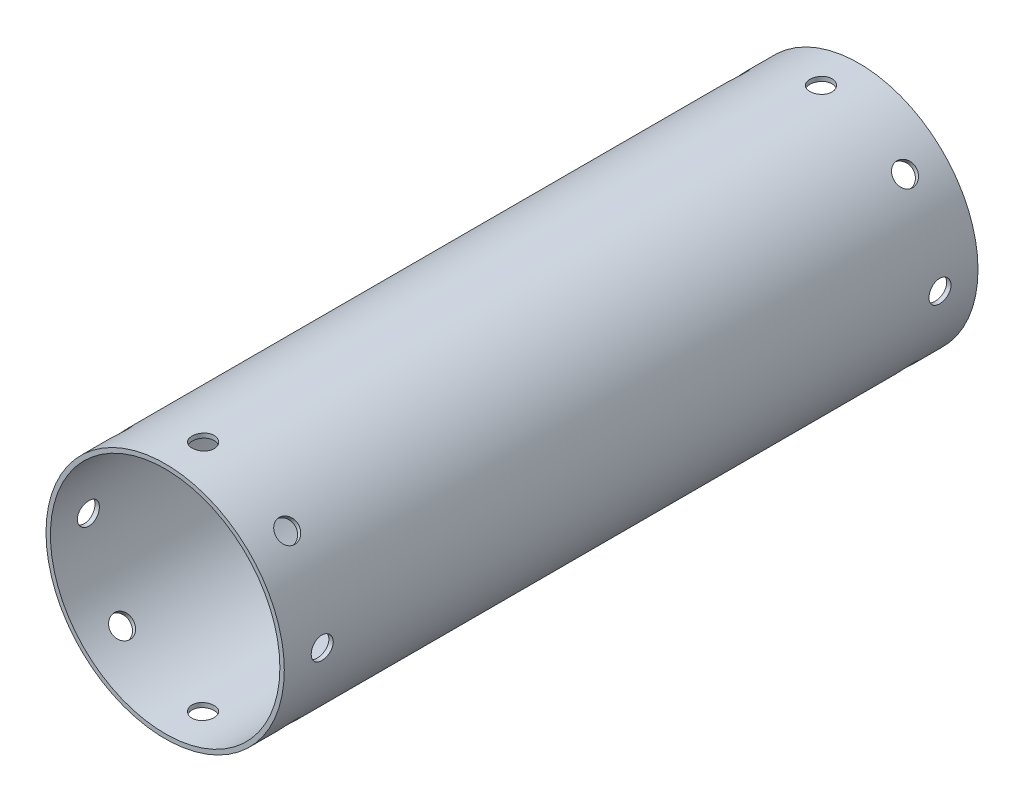
from build123d import *

# Parameters (mm, degrees)
SKETCH1_R                      = 27
SKETCH1_R_2                    = 26
BOSS_EXTRUDE1_DEPTH            = 157.2
CUT_EXTRUDE1_REACH             = 163.771
SKETCH2_R                      = 2.5
CUT_EXTRUDE1_DIRECTION_2_DEPTH = 1
LPATTERN1_COUNT                = 2
LPATTERN1_PITCH                = 140
CIRPATTERN2_COPY_1_REACH       = 163.771
CIRPATTERN2_COPY_1_SKETCH_R    = 2.5
CIRPATTERN2_COPY_2_REACH       = 163.771
CIRPATTERN2_COPY_2_SKETCH_R    = 2.5
CIRPATTERN2_COPY_3_REACH       = 163.771
CIRPATTERN2_COPY_3_SKETCH_R    = 2.5
CIRPATTERN2_COPY_4_REACH       = 163.771
CIRPATTERN2_COPY_4_SKETCH_R    = 2.5
CIRPATTERN2_COPY_5_REACH       = 163.771
CIRPATTERN2_COPY_5_SKETCH_R    = 2.5
CIRPATTERN2_COPY_6_REACH       = 163.771
CIRPATTERN2_COPY_6_SKETCH_R    = 2.5
CIRPATTERN2_COPY_7_REACH       = 163.771
CIRPATTERN2_COPY_7_SKETCH_R    = 2.5
CIRPATTERN2_COPY_8_SKETCH_R    = 2.5
CIRPATTERN2_COPY_8_DEPTH       = 1
CIRPATTERN2_COPY_9_SKETCH_R    = 2.5
CIRPATTERN2_COPY_9_DEPTH       = 1
CIRPATTERN2_COPY_10_SKETCH_R   = 2.5
CIRPATTERN2_COPY_10_DEPTH      = 1
CIRPATTERN2_COPY_11_SKETCH_R   = 2.5
CIRPATTERN2_COPY_11_DEPTH      = 1
CIRPATTERN2_COPY_12_SKETCH_R   = 2.5
CIRPATTERN2_COPY_12_DEPTH      = 1
CIRPATTERN2_COPY_13_SKETCH_R   = 2.5
CIRPATTERN2_COPY_13_DEPTH      = 1
CIRPATTERN2_COPY_14_SKETCH_R   = 2.5
CIRPATTERN2_COPY_14_DEPTH      = 1
CIRPATTERN2_COPY_15_REACH      = 163.771
CIRPATTERN2_COPY_15_SKETCH_R   = 2.5
CIRPATTERN2_COPY_16_REACH      = 163.771
CIRPATTERN2_COPY_16_SKETCH_R   = 2.5
CIRPATTERN2_COPY_17_REACH      = 163.771
CIRPATTERN2_COPY_17_SKETCH_R   = 2.5
CIRPATTERN2_COPY_18_REACH      = 163.771
CIRPATTERN2_COPY_18_SKETCH_R   = 2.5
CIRPATTERN2_COPY_19_REACH      = 163.771
CIRPATTERN2_COPY_19_SKETCH_R   = 2.5
CIRPATTERN2_COPY_20_REACH      = 163.771
CIRPATTERN2_COPY_20_SKETCH_R   = 2.5
CIRPATTERN2_COPY_21_REACH      = 163.771
CIRPATTERN2_COPY_21_SKETCH_R   = 2.5
CIRPATTERN2_COPY_22_SKETCH_R   = 2.5
CIRPATTERN2_COPY_22_DEPTH      = 1
CIRPATTERN2_COPY_23_SKETCH_R   = 2.5
CIRPATTERN2_COPY_23_DEPTH      = 1
CIRPATTERN2_COPY_24_SKETCH_R   = 2.5
CIRPATTERN2_COPY_24_DEPTH      = 1
CIRPATTERN2_COPY_25_SKETCH_R   = 2.5
CIRPATTERN2_COPY_25_DEPTH      = 1
CIRPATTERN2_COPY_26_SKETCH_R   = 2.5
CIRPATTERN2_COPY_26_DEPTH      = 1
CIRPATTERN2_COPY_27_SKETCH_R   = 2.5
CIRPATTERN2_COPY_27_DEPTH      = 1
CIRPATTERN2_COPY_28_SKETCH_R   = 2.5
CIRPATTERN2_COPY_28_DEPTH      = 1


with BuildPart() as part:
    # Sketch1 → Boss-Extrude1 (new body)
    with BuildSketch(Plane.XY):
        Circle(SKETCH1_R)
        Circle(SKETCH1_R_2, mode=Mode.SUBTRACT)
    extrude(amount=BOSS_EXTRUDE1_DEPTH)

    # Sketch2 → Cut-Extrude1 (cut, up to next)
    with BuildSketch(Plane(origin=(0, 0, 0), x_dir=(1, 0, 0), z_dir=(0, 1, 0)), mode=Mode.PRIVATE) as cut_extrude1_sk1:
        with Locations((0, -8.6)):
            Circle(SKETCH2_R)
    cut_extrude1_tool1 = extrude(cut_extrude1_sk1.sketch, amount=-CUT_EXTRUDE1_REACH, mode=Mode.PRIVATE) & part.part
    cut_extrude1 = cut_extrude1_tool1.solids().sort_by_distance((0, 0, 8.6))[0]
    add(cut_extrude1, mode=Mode.SUBTRACT)

    # Sketch2 → Cut-Extrude1 direction 2 (cut)
    with BuildSketch(Plane(origin=(0, 0, 0), x_dir=(1, 0, 0), z_dir=(0, 1, 0))):
        with Locations((0, -8.6)):
            Circle(SKETCH2_R)
    cut_extrude1_direction_2 = extrude(amount=CUT_EXTRUDE1_DIRECTION_2_DEPTH, mode=Mode.SUBTRACT)

    # LPattern1: Cut-Extrude1, Cut-Extrude1 direction 2 ×2
    with Locations(*[(0, 0, i * LPATTERN1_PITCH) for i in range(1, LPATTERN1_COUNT)]):
        add(cut_extrude1, mode=Mode.SUBTRACT)
        add(cut_extrude1_direction_2, mode=Mode.SUBTRACT)

    # CirPattern2 copy 1 sketch → CirPattern2 copy 1 (cut, up to next)
    with BuildSketch(Plane(origin=(0, 0, 140), x_dir=(0.7071067811865476, -0.7071067811865475, 0), z_dir=(0.7071067811865475, 0.7071067811865476, 0)), mode=Mode.PRIVATE) as cirpattern2_copy_1_sk1:
        with Locations((0, -8.6)):
            Circle(CIRPATTERN2_COPY_1_SKETCH_R)
    cirpattern2_copy_1_tool1 = extrude(cirpattern2_copy_1_sk1.sketch, amount=-CIRPATTERN2_COPY_1_REACH, mode=Mode.PRIVATE) & part.part
    add(cirpattern2_copy_1_tool1.solids().sort_by_distance((0, 0, 148.6))[0], mode=Mode.SUBTRACT)

    # CirPattern2 copy 2 sketch → CirPattern2 copy 2 (cut, up to next)
    with BuildSketch(Plane(origin=(0, 0, 140), x_dir=(0, -1, 0), z_dir=(1, 0, 0)), mode=Mode.PRIVATE) as cirpattern2_copy_2_sk1:
        with Locations((0, -8.6)):
            Circle(CIRPATTERN2_COPY_2_SKETCH_R)
    cirpattern2_copy_2_tool1 = extrude(cirpattern2_copy_2_sk1.sketch, amount=-CIRPATTERN2_COPY_2_REACH, mode=Mode.PRIVATE) & part.part
    add(cirpattern2_copy_2_tool1.solids().sort_by_distance((0, 0, 148.6))[0], mode=Mode.SUBTRACT)

    # CirPattern2 copy 3 sketch → CirPattern2 copy 3 (cut, up to next)
    with BuildSketch(Plane(origin=(0, 0, 140), x_dir=(-0.7071067811865475, -0.7071067811865476, 0), z_dir=(0.7071067811865476, -0.7071067811865475, 0)), mode=Mode.PRIVATE) as cirpattern2_copy_3_sk1:
        with Locations((0, -8.6)):
            Circle(CIRPATTERN2_COPY_3_SKETCH_R)
    cirpattern2_copy_3_tool1 = extrude(cirpattern2_copy_3_sk1.sketch, amount=-CIRPATTERN2_COPY_3_REACH, mode=Mode.PRIVATE) & part.part
    add(cirpattern2_copy_3_tool1.solids().sort_by_distance((0, 0, 148.6))[0], mode=Mode.SUBTRACT)

    # CirPattern2 copy 4 sketch → CirPattern2 copy 4 (cut, up to next)
    with BuildSketch(Plane(origin=(0, 0, 140), x_dir=(-1, 0, 0), z_dir=(0, -1, 0)), mode=Mode.PRIVATE) as cirpattern2_copy_4_sk1:
        with Locations((0, -8.6)):
            Circle(CIRPATTERN2_COPY_4_SKETCH_R)
    cirpattern2_copy_4_tool1 = extrude(cirpattern2_copy_4_sk1.sketch, amount=-CIRPATTERN2_COPY_4_REACH, mode=Mode.PRIVATE) & part.part
    add(cirpattern2_copy_4_tool1.solids().sort_by_distance((0, 0, 148.6))[0], mode=Mode.SUBTRACT)

    # CirPattern2 copy 5 sketch → CirPattern2 copy 5 (cut, up to next)
    with BuildSketch(Plane(origin=(0, 0, 140), x_dir=(-0.7071067811865477, 0.7071067811865475, 0), z_dir=(-0.7071067811865475, -0.7071067811865477, 0)), mode=Mode.PRIVATE) as cirpattern2_copy_5_sk1:
        with Locations((0, -8.6)):
            Circle(CIRPATTERN2_COPY_5_SKETCH_R)
    cirpattern2_copy_5_tool1 = extrude(cirpattern2_copy_5_sk1.sketch, amount=-CIRPATTERN2_COPY_5_REACH, mode=Mode.PRIVATE) & part.part
    add(cirpattern2_copy_5_tool1.solids().sort_by_distance((0, 0, 148.6))[0], mode=Mode.SUBTRACT)

    # CirPattern2 copy 6 sketch → CirPattern2 copy 6 (cut, up to next)
    with BuildSketch(Plane(origin=(0, 0, 140), x_dir=(0, 1, 0), z_dir=(-1, 0, 0)), mode=Mode.PRIVATE) as cirpattern2_copy_6_sk1:
        with Locations((0, -8.6)):
            Circle(CIRPATTERN2_COPY_6_SKETCH_R)
    cirpattern2_copy_6_tool1 = extrude(cirpattern2_copy_6_sk1.sketch, amount=-CIRPATTERN2_COPY_6_REACH, mode=Mode.PRIVATE) & part.part
    add(cirpattern2_copy_6_tool1.solids().sort_by_distance((0, 0, 148.6))[0], mode=Mode.SUBTRACT)

    # CirPattern2 copy 7 sketch → CirPattern2 copy 7 (cut, up to next)
    with BuildSketch(Plane(origin=(0, 0, 140), x_dir=(0.7071067811865474, 0.7071067811865477, 0), z_dir=(-0.7071067811865477, 0.7071067811865474, 0)), mode=Mode.PRIVATE) as cirpattern2_copy_7_sk1:
        with Locations((0, -8.6)):
            Circle(CIRPATTERN2_COPY_7_SKETCH_R)
    cirpattern2_copy_7_tool1 = extrude(cirpattern2_copy_7_sk1.sketch, amount=-CIRPATTERN2_COPY_7_REACH, mode=Mode.PRIVATE) & part.part
    add(cirpattern2_copy_7_tool1.solids().sort_by_distance((0, 0, 148.6))[0], mode=Mode.SUBTRACT)

    # CirPattern2 copy 8 sketch → CirPattern2 copy 8 (cut)
    with BuildSketch(Plane(origin=(0, 0, 140), x_dir=(0.7071067811865476, -0.7071067811865475, 0), z_dir=(0.7071067811865475, 0.7071067811865476, 0))):
        with Locations((0, -8.6)):
            Circle(CIRPATTERN2_COPY_8_SKETCH_R)
    extrude(amount=CIRPATTERN2_COPY_8_DEPTH, mode=Mode.SUBTRACT)

    # CirPattern2 copy 9 sketch → CirPattern2 copy 9 (cut)
    with BuildSketch(Plane(origin=(0, 0, 140), x_dir=(0, -1, 0), z_dir=(1, 0, 0))):
        with Locations((0, -8.6)):
            Circle(CIRPATTERN2_COPY_9_SKETCH_R)
    extrude(amount=CIRPATTERN2_COPY_9_DEPTH, mode=Mode.SUBTRACT)

    # CirPattern2 copy 10 sketch → CirPattern2 copy 10 (cut)
    with BuildSketch(Plane(origin=(0, 0, 140), x_dir=(-0.7071067811865475, -0.7071067811865476, 0), z_dir=(0.7071067811865476, -0.7071067811865475, 0))):
        with Locations((0, -8.6)):
            Circle(CIRPATTERN2_COPY_10_SKETCH_R)
    extrude(amount=CIRPATTERN2_COPY_10_DEPTH, mode=Mode.SUBTRACT)

    # CirPattern2 copy 11 sketch → CirPattern2 copy 11 (cut)
    with BuildSketch(Plane(origin=(0, 0, 140), x_dir=(-1, 0, 0), z_dir=(0, -1, 0))):
        with Locations((0, -8.6)):
            Circle(CIRPATTERN2_COPY_11_SKETCH_R)
    extrude(amount=CIRPATTERN2_COPY_11_DEPTH, mode=Mode.SUBTRACT)

    # CirPattern2 copy 12 sketch → CirPattern2 copy 12 (cut)
    with BuildSketch(Plane(origin=(0, 0, 140), x_dir=(-0.7071067811865477, 0.7071067811865475, 0), z_dir=(-0.7071067811865475, -0.7071067811865477, 0))):
        with Locations((0, -8.6)):
            Circle(CIRPATTERN2_COPY_12_SKETCH_R)
    extrude(amount=CIRPATTERN2_COPY_12_DEPTH, mode=Mode.SUBTRACT)

    # CirPattern2 copy 13 sketch → CirPattern2 copy 13 (cut)
    with BuildSketch(Plane(origin=(0, 0, 140), x_dir=(0, 1, 0), z_dir=(-1, 0, 0))):
        with Locations((0, -8.6)):
            Circle(CIRPATTERN2_COPY_13_SKETCH_R)
    extrude(amount=CIRPATTERN2_COPY_13_DEPTH, mode=Mode.SUBTRACT)

    # CirPattern2 copy 14 sketch → CirPattern2 copy 14 (cut)
    with BuildSketch(Plane(origin=(0, 0, 140), x_dir=(0.7071067811865474, 0.7071067811865477, 0), z_dir=(-0.7071067811865477, 0.7071067811865474, 0))):
        with Locations((0, -8.6)):
            Circle(CIRPATTERN2_COPY_14_SKETCH_R)
    extrude(amount=CIRPATTERN2_COPY_14_DEPTH, mode=Mode.SUBTRACT)

    # CirPattern2 copy 15 sketch → CirPattern2 copy 15 (cut, up to next)
    with BuildSketch(Plane(origin=(0, 0, 0), x_dir=(0.7071067811865476, -0.7071067811865475, 0), z_dir=(0.7071067811865475, 0.7071067811865476, 0)), mode=Mode.PRIVATE) as cirpattern2_copy_15_sk1:
        with Locations((0, -8.6)):
            Circle(CIRPATTERN2_COPY_15_SKETCH_R)
    cirpattern2_copy_15_tool1 = extrude(cirpattern2_copy_15_sk1.sketch, amount=-CIRPATTERN2_COPY_15_REACH, mode=Mode.PRIVATE) & part.part
    add(cirpattern2_copy_15_tool1.solids().sort_by_distance((0, 0, 8.6))[0], mode=Mode.SUBTRACT)

    # CirPattern2 copy 16 sketch → CirPattern2 copy 16 (cut, up to next)
    with BuildSketch(Plane(origin=(0, 0, 0), x_dir=(0, -1, 0), z_dir=(1, 0, 0)), mode=Mode.PRIVATE) as cirpattern2_copy_16_sk1:
        with Locations((0, -8.6)):
            Circle(CIRPATTERN2_COPY_16_SKETCH_R)
    cirpattern2_copy_16_tool1 = extrude(cirpattern2_copy_16_sk1.sketch, amount=-CIRPATTERN2_COPY_16_REACH, mode=Mode.PRIVATE) & part.part
    add(cirpattern2_copy_16_tool1.solids().sort_by_distance((0, 0, 8.6))[0], mode=Mode.SUBTRACT)

    # CirPattern2 copy 17 sketch → CirPattern2 copy 17 (cut, up to next)
    with BuildSketch(Plane(origin=(0, 0, 0), x_dir=(-0.7071067811865475, -0.7071067811865476, 0), z_dir=(0.7071067811865476, -0.7071067811865475, 0)), mode=Mode.PRIVATE) as cirpattern2_copy_17_sk1:
        with Locations((0, -8.6)):
            Circle(CIRPATTERN2_COPY_17_SKETCH_R)
    cirpattern2_copy_17_tool1 = extrude(cirpattern2_copy_17_sk1.sketch, amount=-CIRPATTERN2_COPY_17_REACH, mode=Mode.PRIVATE) & part.part
    add(cirpattern2_copy_17_tool1.solids().sort_by_distance((0, 0, 8.6))[0], mode=Mode.SUBTRACT)

    # CirPattern2 copy 18 sketch → CirPattern2 copy 18 (cut, up to next)
    with BuildSketch(Plane(origin=(0, 0, 0), x_dir=(-1, 0, 0), z_dir=(0, -1, 0)), mode=Mode.PRIVATE) as cirpattern2_copy_18_sk1:
        with Locations((0, -8.6)):
            Circle(CIRPATTERN2_COPY_18_SKETCH_R)
    cirpattern2_copy_18_tool1 = extrude(cirpattern2_copy_18_sk1.sketch, amount=-CIRPATTERN2_COPY_18_REACH, mode=Mode.PRIVATE) & part.part
    add(cirpattern2_copy_18_tool1.solids().sort_by_distance((0, 0, 8.6))[0], mode=Mode.SUBTRACT)

    # CirPattern2 copy 19 sketch → CirPattern2 copy 19 (cut, up to next)
    with BuildSketch(Plane(origin=(0, 0, 0), x_dir=(-0.7071067811865477, 0.7071067811865475, 0), z_dir=(-0.7071067811865475, -0.7071067811865477, 0)), mode=Mode.PRIVATE) as cirpattern2_copy_19_sk1:
        with Locations((0, -8.6)):
            Circle(CIRPATTERN2_COPY_19_SKETCH_R)
    cirpattern2_copy_19_tool1 = extrude(cirpattern2_copy_19_sk1.sketch, amount=-CIRPATTERN2_COPY_19_REACH, mode=Mode.PRIVATE) & part.part
    add(cirpattern2_copy_19_tool1.solids().sort_by_distance((0, 0, 8.6))[0], mode=Mode.SUBTRACT)

    # CirPattern2 copy 20 sketch → CirPattern2 copy 20 (cut, up to next)
    with BuildSketch(Plane(origin=(0, 0, 0), x_dir=(0, 1, 0), z_dir=(-1, 0, 0)), mode=Mode.PRIVATE) as cirpattern2_copy_20_sk1:
        with Locations((0, -8.6)):
            Circle(CIRPATTERN2_COPY_20_SKETCH_R)
    cirpattern2_copy_20_tool1 = extrude(cirpattern2_copy_20_sk1.sketch, amount=-CIRPATTERN2_COPY_20_REACH, mode=Mode.PRIVATE) & part.part
    add(cirpattern2_copy_20_tool1.solids().sort_by_distance((0, 0, 8.6))[0], mode=Mode.SUBTRACT)

    # CirPattern2 copy 21 sketch → CirPattern2 copy 21 (cut, up to next)
    with BuildSketch(Plane(origin=(0, 0, 0), x_dir=(0.7071067811865474, 0.7071067811865477, 0), z_dir=(-0.7071067811865477, 0.7071067811865474, 0)), mode=Mode.PRIVATE) as cirpattern2_copy_21_sk1:
        with Locations((0, -8.6)):
            Circle(CIRPATTERN2_COPY_21_SKETCH_R)
    cirpattern2_copy_21_tool1 = extrude(cirpattern2_copy_21_sk1.sketch, amount=-CIRPATTERN2_COPY_21_REACH, mode=Mode.PRIVATE) & part.part
    add(cirpattern2_copy_21_tool1.solids().sort_by_distance((0, 0, 8.6))[0], mode=Mode.SUBTRACT)

    # CirPattern2 copy 22 sketch → CirPattern2 copy 22 (cut)
    with BuildSketch(Plane(origin=(0, 0, 0), x_dir=(0.7071067811865476, -0.7071067811865475, 0), z_dir=(0.7071067811865475, 0.7071067811865476, 0))):
        with Locations((0, -8.6)):
            Circle(CIRPATTERN2_COPY_22_SKETCH_R)
    extrude(amount=CIRPATTERN2_COPY_22_DEPTH, mode=Mode.SUBTRACT)

    # CirPattern2 copy 23 sketch → CirPattern2 copy 23 (cut)
    with BuildSketch(Plane(origin=(0, 0, 0), x_dir=(0, -1, 0), z_dir=(1, 0, 0))):
        with Locations((0, -8.6)):
            Circle(CIRPATTERN2_COPY_23_SKETCH_R)
    extrude(amount=CIRPATTERN2_COPY_23_DEPTH, mode=Mode.SUBTRACT)

    # CirPattern2 copy 24 sketch → CirPattern2 copy 24 (cut)
    with BuildSketch(Plane(origin=(0, 0, 0), x_dir=(-0.7071067811865475, -0.7071067811865476, 0), z_dir=(0.7071067811865476, -0.7071067811865475, 0))):
        with Locations((0, -8.6)):
            Circle(CIRPATTERN2_COPY_24_SKETCH_R)
    extrude(amount=CIRPATTERN2_COPY_24_DEPTH, mode=Mode.SUBTRACT)

    # CirPattern2 copy 25 sketch → CirPattern2 copy 25 (cut)
    with BuildSketch(Plane(origin=(0, 0, 0), x_dir=(-1, 0, 0), z_dir=(0, -1, 0))):
        with Locations((0, -8.6)):
            Circle(CIRPATTERN2_COPY_25_SKETCH_R)
    extrude(amount=CIRPATTERN2_COPY_25_DEPTH, mode=Mode.SUBTRACT)

    # CirPattern2 copy 26 sketch → CirPattern2 copy 26 (cut)
    with BuildSketch(Plane(origin=(0, 0, 0), x_dir=(-0.7071067811865477, 0.7071067811865475, 0), z_dir=(-0.7071067811865475, -0.7071067811865477, 0))):
        with Locations((0, -8.6)):
            Circle(CIRPATTERN2_COPY_26_SKETCH_R)
    extrude(amount=CIRPATTERN2_COPY_26_DEPTH, mode=Mode.SUBTRACT)

    # CirPattern2 copy 27 sketch → CirPattern2 copy 27 (cut)
    with BuildSketch(Plane(origin=(0, 0, 0), x_dir=(0, 1, 0), z_dir=(-1, 0, 0))):
        with Locations((0, -8.6)):
            Circle(CIRPATTERN2_COPY_27_SKETCH_R)
    extrude(amount=CIRPATTERN2_COPY_27_DEPTH, mode=Mode.SUBTRACT)

    # CirPattern2 copy 28 sketch → CirPattern2 copy 28 (cut)
    with BuildSketch(Plane(origin=(0, 0, 0), x_dir=(0.7071067811865474, 0.7071067811865477, 0), z_dir=(-0.7071067811865477, 0.7071067811865474, 0))):
        with Locations((0, -8.6)):
            Circle(CIRPATTERN2_COPY_28_SKETCH_R)
    extrude(amount=CIRPATTERN2_COPY_28_DEPTH, mode=Mode.SUBTRACT)


solid = part.part
